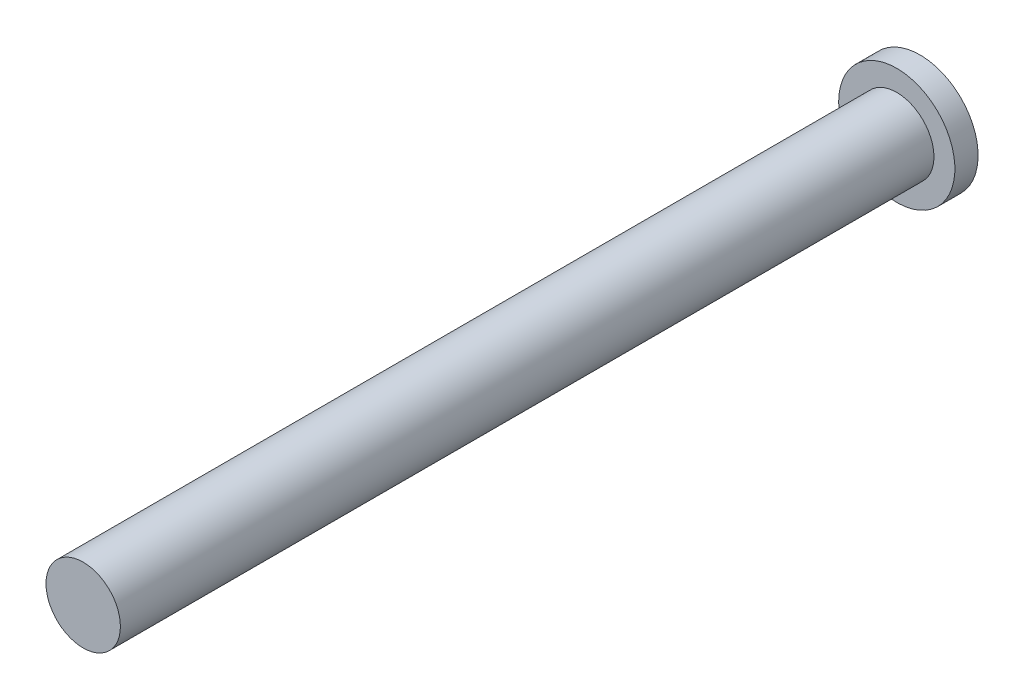
from build123d import *

# Parameters (mm, degrees)
SKETCH2_R           = 1.6
BOSS_EXTRUDE1_DEPTH = 35
SKETCH4_R           = 2.5
BOSS_EXTRUDE2_DEPTH = 1


with BuildPart() as part:
    # Sketch2 → Boss-Extrude1 (new body)
    with BuildSketch(Plane.XY):
        Circle(SKETCH2_R)
    extrude(amount=BOSS_EXTRUDE1_DEPTH)

    # Sketch4 → Boss-Extrude2 (add)
    with BuildSketch(Plane(origin=(0, 0, 0), x_dir=(-1, 0, 0), z_dir=(0, 0, -1))):
        Circle(SKETCH4_R)
    extrude(amount=BOSS_EXTRUDE2_DEPTH)


solid = part.part
